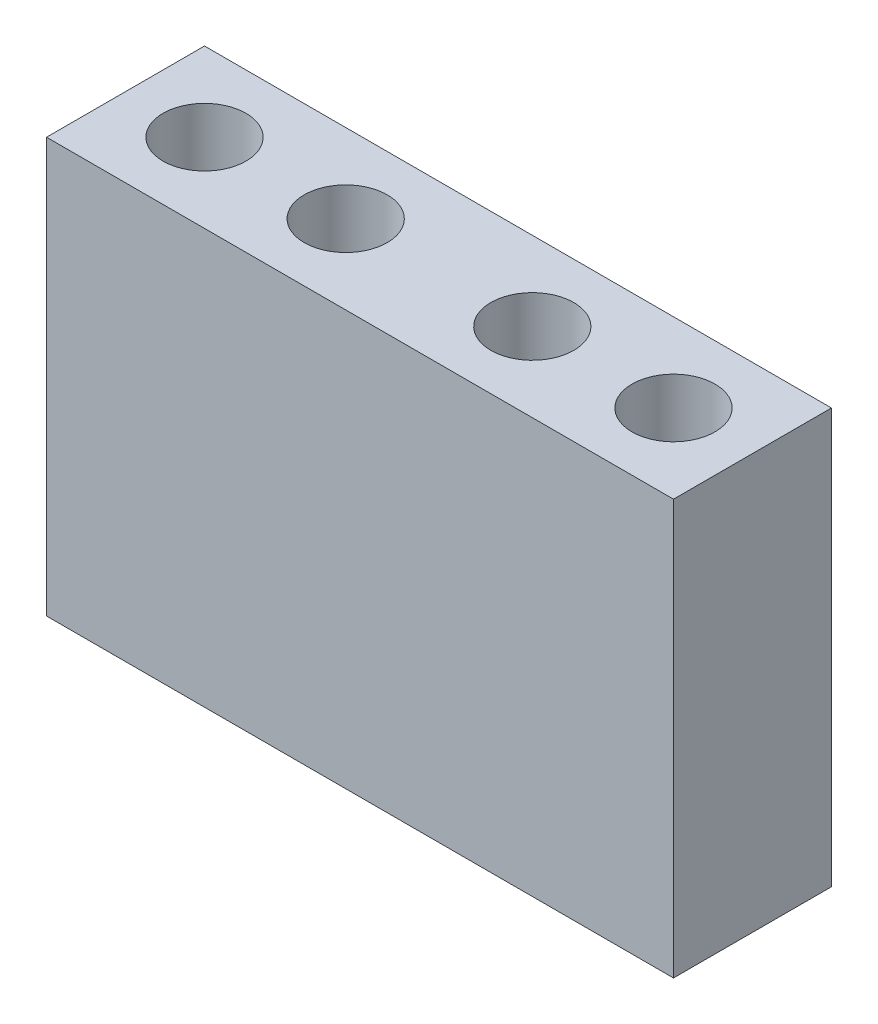
from build123d import *

# Parameters (mm, degrees)
SKETCH1_W           = 31.75
SKETCH1_H           = 8
SKETCH1_R           = 2.1
BOSS_EXTRUDE1_DEPTH = 21
SKETCH4_R           = 2.1
CUT_EXTRUDE3_DEPTH  = 38.5
SKETCH6_R           = 2.1
BOSS_EXTRUDE3_DEPTH = 2
SKETCH7_R           = 2.1
BOSS_EXTRUDE4_DEPTH = 2


with BuildPart() as part:
    # Sketch1 → Boss-Extrude1 (new body)
    with BuildSketch(Plane(origin=(0, 0, 0), x_dir=(1, 0, 0), z_dir=(0, 1, 0))):
        with Locations((4.725, 0)):
            Rectangle(SKETCH1_W, SKETCH1_H)
        with Locations(Location((0, 0, 0), (0, 0, 90))):
            Circle(SKETCH1_R, mode=Mode.SUBTRACT)
        with Locations(Location((-7.15, 0, 0), (0, 0, 90))):
            Circle(SKETCH1_R, mode=Mode.SUBTRACT)
        with Locations(Location((9.45, 0, 0), (0, 0, 90))):
            Circle(SKETCH1_R, mode=Mode.SUBTRACT)
        with Locations(Location((16.6, 0, 0), (0, 0, 90))):
            Circle(SKETCH1_R, mode=Mode.SUBTRACT)
    extrude(amount=BOSS_EXTRUDE1_DEPTH)

    # Sketch4 → Cut-Extrude3 (cut)
    with BuildSketch(Plane(origin=(20.6, 0, 0), x_dir=(0, 0, -1), z_dir=(1, 0, 0))):
        with Locations((0, 4)):
            Circle(SKETCH4_R)
    extrude(amount=-CUT_EXTRUDE3_DEPTH, mode=Mode.SUBTRACT)

    # Sketch6 → Boss-Extrude3 (add)
    with BuildSketch(Plane.XZ):
        with Locations(Location((-7.15, 0, 0), (0, 0, 90))):
            Circle(SKETCH6_R)
        with Locations(Location((0, 0, 0), (0, 0, 90))):
            Circle(SKETCH6_R)
        with Locations(Location((9.45, 0, 0), (0, 0, 90))):
            Circle(SKETCH6_R)
        with Locations(Location((16.6, 0, 0), (0, 0, 90))):
            Circle(SKETCH6_R)
    extrude(amount=-BOSS_EXTRUDE3_DEPTH)

    # Sketch7 → Boss-Extrude4 (add)
    with BuildSketch(Plane(origin=(20.6, 0, 0), x_dir=(0, 0, -1), z_dir=(1, 0, 0))):
        with Locations((0, 4)):
            Circle(SKETCH7_R)
    extrude(amount=-BOSS_EXTRUDE4_DEPTH)


solid = part.part
